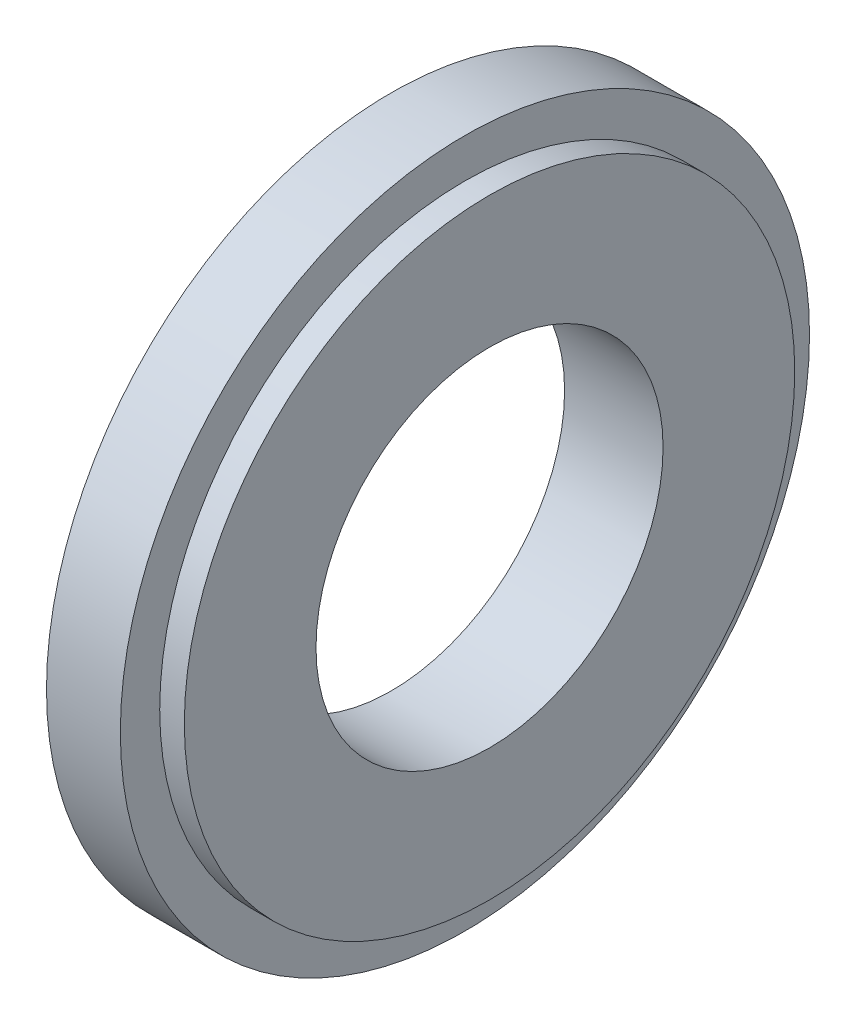
from build123d import *

# Parameters (mm, degrees)
WYTNIJ_WYCI_GNI_CIE1_DEPTH      = 101.995049384
WYTNIJ_WYCI_GNI_CIE1_DEPTH_BACK = 101.995049384
SZKIC2_R                        = 35.25


with BuildPart() as part:
    # Szkic1 → Obrót1 (revolve)
    with BuildSketch(Plane.XY, mode=Mode.PRIVATE) as obr_t1_sk:
        Polygon((-100.302885934, 0), (-100.302885934, 70), (-85.302885934, 70), (-85.302885934, 62), (-80.302885934, 62), (-80.302885934, 0), align=None)
    revolve(obr_t1_sk.sketch.rotate(Axis((0, 0, 0), (1, 0, 0)), 90), axis=Axis((0, 0, 0), (1, 0, 0)))

    # Szkic2 → Wytnij-wyciągnięcie1 (cut, two sides: drawn at the far end of the back side and taken through both)
    with BuildSketch(Plane(origin=(-80.302885934, 0, 0), x_dir=(0, 0, -1), z_dir=(1, 0, 0)).offset(-WYTNIJ_WYCI_GNI_CIE1_DEPTH_BACK)):
        Circle(SZKIC2_R)
    extrude(amount=WYTNIJ_WYCI_GNI_CIE1_DEPTH + WYTNIJ_WYCI_GNI_CIE1_DEPTH_BACK, mode=Mode.SUBTRACT)


solid = part.part
